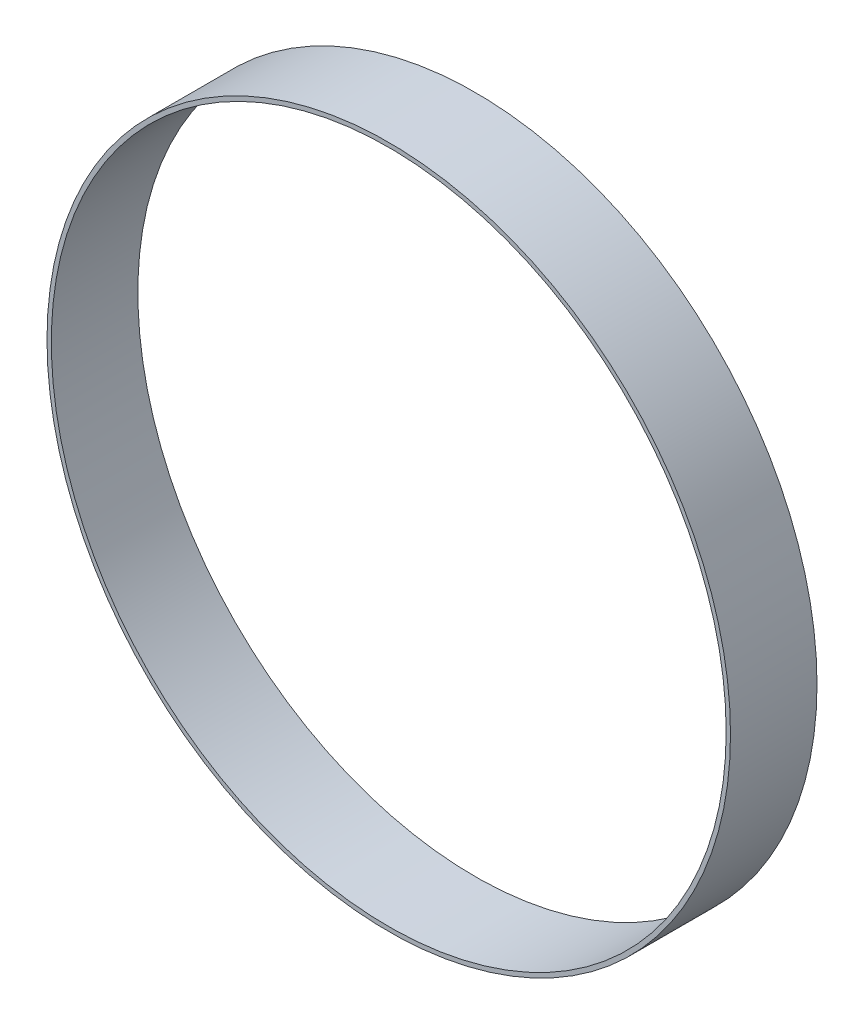
from build123d import *

# Parameters (mm, degrees)
CROQUIS1_R              = 39.5
CROQUIS1_R_2            = 39
SALIENTE_EXTRUIR1_DEPTH = 5


with BuildPart() as part:
    # Croquis1 → Saliente-Extruir1 (new, symmetric)
    with BuildSketch(Plane.XY):
        Circle(CROQUIS1_R)
        Circle(CROQUIS1_R_2, mode=Mode.SUBTRACT)
    extrude(amount=SALIENTE_EXTRUIR1_DEPTH, both=True)


solid = part.part
